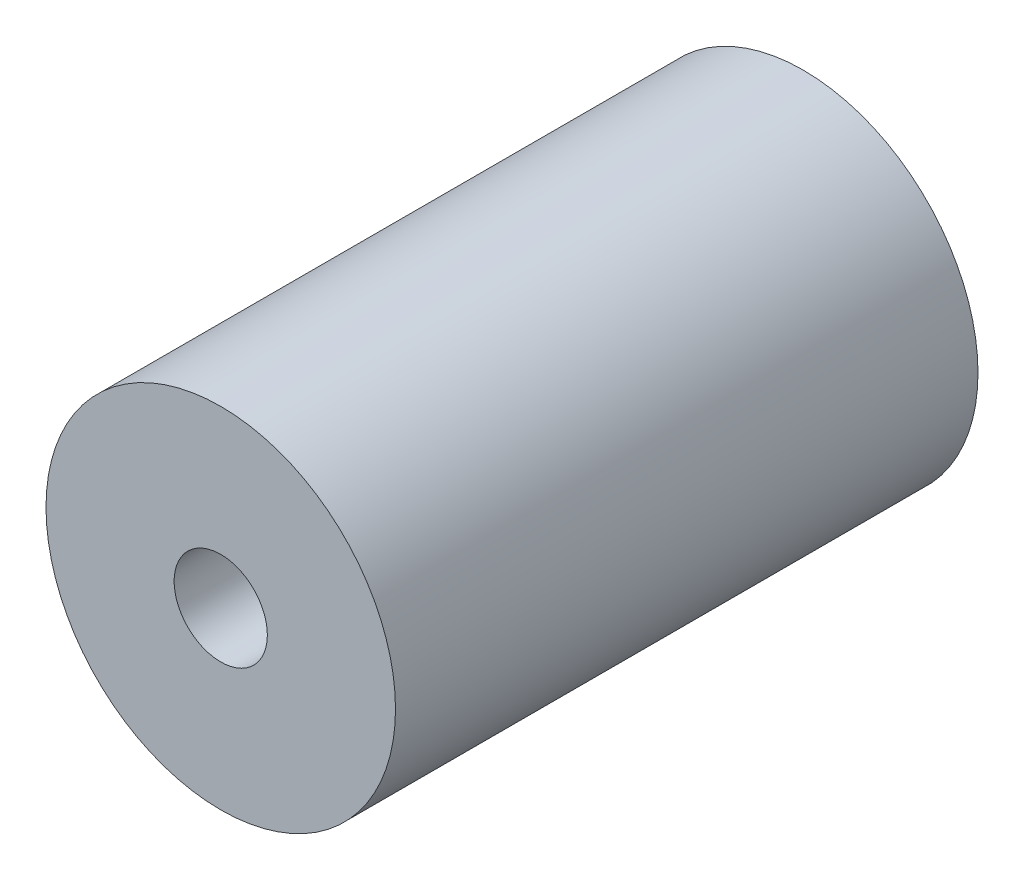
from build123d import *

# Parameters (mm, degrees)
SKETCH1_R           = 3
SKETCH1_R_2         = 0.8
BOSS_EXTRUDE1_DEPTH = 10


with BuildPart() as part:
    # Sketch1 → Boss-Extrude1 (new body)
    with BuildSketch(Plane.XY):
        Circle(SKETCH1_R)
        Circle(SKETCH1_R_2, mode=Mode.SUBTRACT)
    extrude(amount=BOSS_EXTRUDE1_DEPTH)


solid = part.part
